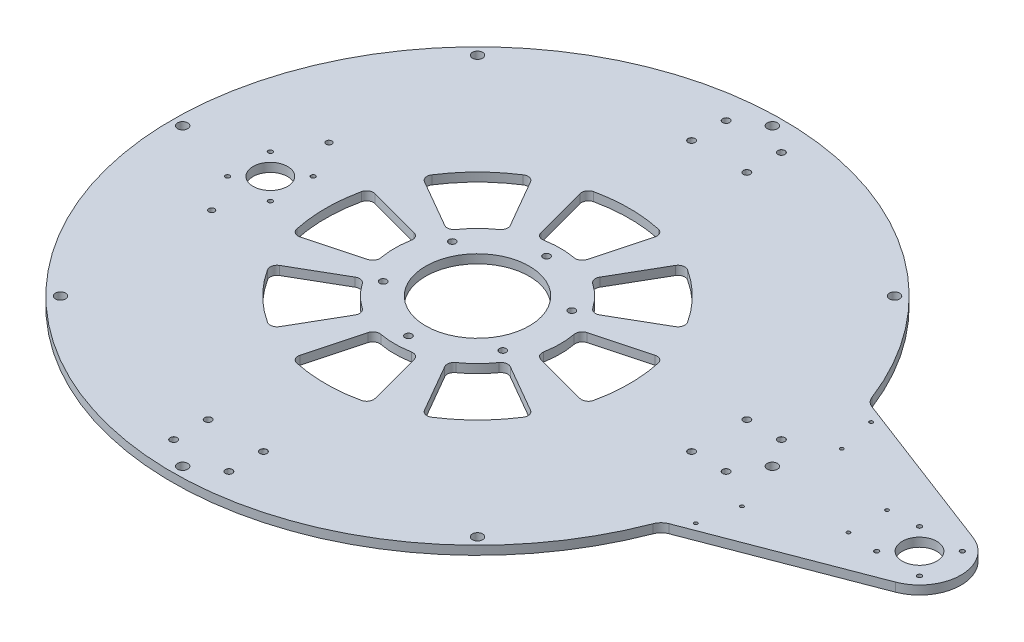
from build123d import *

# Parameters (mm, degrees)
SKETCH1_R                             = 12.5
SKETCH1_R_2                           = 37.5
BOSS_EXTRUDE1_DEPTH                   = 6.35
M7_CLEARANCE_HOLE1_D                  = 7.4
M3_CLEARANCE_HOLE3_D                  = 3.2
TAP_DRILL_FOR_M5X0_8_TAP2_D           = 4.2
FILLET1_R                             = 10
M3_CLEARANCE_HOLE2_D                  = 3.2
TAP_DRILL_FOR_M6X1_0_TAP1_D           = 5
TAP_DRILL_FOR_M6X1_0_TAP1_CSINK_D     = 5.05
TAP_DRILL_FOR_M6X1_0_TAP1_CSINK_ANGLE = 90
TAP_DRILL_FOR_M3X0_5_TAP2_D           = 2.5
TAP_DRILL_FOR_M6X1_0_TAP2_D           = 5


with BuildPart() as part:
    # Sketch1 → Boss-Extrude1 (new body)
    with BuildSketch(Plane(origin=(0, 0, 0), x_dir=(1, 0, 0), z_dir=(0, 1, 0))):
        with BuildLine():
            Line((330.716951859, 28.020473637), (207.884583363, 75))
            ThreePointArc((207.884583363, 75), (-221, 0), (207.884583363, -75))
            Line((207.884583363, -75), (330.716951859, -28.020473637))
            ThreePointArc((330.716951859, -28.020473637), (350, 0), (330.716951859, 28.020473637))
        make_face()
        with Locations(Location((320, 0, 0), (0, 0, 270))):
            Circle(SKETCH1_R, mode=Mode.SUBTRACT)
        with BuildLine():
            ThreePointArc((11.025011132, 58.978378492), (0, 60), (-11.025011132, 58.978378492))
            ThreePointArc((-11.025011132, 58.978378492), (-14.608576367, 59.662550195), (-16.773391191, 62.599148141))
            Line((-16.773391191, 62.599148141), (-27.145170458, 101.307155329))
            ThreePointArc((-27.145170458, 101.307155329), (-26.584899416, 105.203668949), (-23.378186151, 107.48702439))
            ThreePointArc((-23.378186151, 107.48702439), (0, 110), (23.378186151, 107.48702439))
            ThreePointArc((23.378186151, 107.48702439), (26.584899416, 105.203668949), (27.145170458, 101.307155329))
            Line((27.145170458, 101.307155329), (16.773391191, 62.599148141))
            ThreePointArc((16.773391191, 62.599148141), (14.608576367, 59.662550195), (11.025011132, 58.978378492))
        make_face(mode=Mode.SUBTRACT)
        with BuildLine():
            Line((-32.403703492, -56.124860802), (-52.440442409, -90.829510623))
            ThreePointArc((-52.440442409, -90.829510623), (-55.591865065, -93.188590374), (-59.473929876, -92.535677795))
            ThreePointArc((-59.473929876, -92.535677795), (-77.781745931, -77.781745931), (-92.535677795, -59.473929876))
            ThreePointArc((-92.535677795, -59.473929876), (-93.188590374, -55.591865065), (-90.829510623, -52.440442409))
            Line((-90.829510623, -52.440442409), (-56.124860802, -32.403703492))
            ThreePointArc((-56.124860802, -32.403703492), (-52.517617239, -31.857970413), (-49.499871509, -33.908151241))
            ThreePointArc((-49.499871509, -33.908151241), (-42.426406871, -42.426406871), (-33.908151241, -49.499871509))
            ThreePointArc((-33.908151241, -49.499871509), (-31.857970413, -52.517617239), (-32.403703492, -56.124860802))
        make_face(mode=Mode.SUBTRACT)
        with BuildLine():
            Line((16.773391191, -62.599148141), (27.145170458, -101.307155329))
            ThreePointArc((27.145170458, -101.307155329), (26.584899416, -105.203668949), (23.378186151, -107.48702439))
            ThreePointArc((23.378186151, -107.48702439), (0, -110), (-23.378186151, -107.48702439))
            ThreePointArc((-23.378186151, -107.48702439), (-26.584899416, -105.203668949), (-27.145170458, -101.307155329))
            Line((-27.145170458, -101.307155329), (-16.773391191, -62.599148141))
            ThreePointArc((-16.773391191, -62.599148141), (-14.608576367, -59.662550195), (-11.025011132, -58.978378492))
            ThreePointArc((-11.025011132, -58.978378492), (0, -60), (11.025011132, -58.978378492))
            ThreePointArc((11.025011132, -58.978378492), (14.608576367, -59.662550195), (16.773391191, -62.599148141))
        make_face(mode=Mode.SUBTRACT)
        with BuildLine():
            Line((56.124860802, -32.403703492), (90.829510623, -52.440442409))
            ThreePointArc((90.829510623, -52.440442409), (93.188590374, -55.591865065), (92.535677795, -59.473929876))
            ThreePointArc((92.535677795, -59.473929876), (77.781745931, -77.781745931), (59.473929876, -92.535677795))
            ThreePointArc((59.473929876, -92.535677795), (55.591865065, -93.188590374), (52.440442409, -90.829510623))
            Line((52.440442409, -90.829510623), (32.403703492, -56.124860802))
            ThreePointArc((32.403703492, -56.124860802), (31.857970413, -52.517617239), (33.908151241, -49.499871509))
            ThreePointArc((33.908151241, -49.499871509), (42.426406871, -42.426406871), (49.499871509, -33.908151241))
            ThreePointArc((49.499871509, -33.908151241), (52.517617239, -31.857970413), (56.124860802, -32.403703492))
        make_face(mode=Mode.SUBTRACT)
        with BuildLine():
            Line((62.599148141, 16.773391191), (101.307155329, 27.145170458))
            ThreePointArc((101.307155329, 27.145170458), (105.203668949, 26.584899416), (107.48702439, 23.378186151))
            ThreePointArc((107.48702439, 23.378186151), (110, 0), (107.48702439, -23.378186151))
            ThreePointArc((107.48702439, -23.378186151), (105.203668949, -26.584899416), (101.307155329, -27.145170458))
            Line((101.307155329, -27.145170458), (62.599148141, -16.773391191))
            ThreePointArc((62.599148141, -16.773391191), (59.662550195, -14.608576367), (58.978378492, -11.025011132))
            ThreePointArc((58.978378492, -11.025011132), (60, 0), (58.978378492, 11.025011132))
            ThreePointArc((58.978378492, 11.025011132), (59.662550195, 14.608576367), (62.599148141, 16.773391191))
        make_face(mode=Mode.SUBTRACT)
        with Locations(Location((-150, 0, 0), (0, 0, 270))):
            Circle(SKETCH1_R, mode=Mode.SUBTRACT)
        with BuildLine():
            Line((-62.599148141, -16.773391191), (-101.307155329, -27.145170458))
            ThreePointArc((-101.307155329, -27.145170458), (-105.203668949, -26.584899416), (-107.48702439, -23.378186151))
            ThreePointArc((-107.48702439, -23.378186151), (-110, 0), (-107.48702439, 23.378186151))
            ThreePointArc((-107.48702439, 23.378186151), (-105.203668949, 26.584899416), (-101.307155329, 27.145170458))
            Line((-101.307155329, 27.145170458), (-62.599148141, 16.773391191))
            ThreePointArc((-62.599148141, 16.773391191), (-59.662550195, 14.608576367), (-58.978378492, 11.025011132))
            ThreePointArc((-58.978378492, 11.025011132), (-60, 0), (-58.978378492, -11.025011132))
            ThreePointArc((-58.978378492, -11.025011132), (-59.662550195, -14.608576367), (-62.599148141, -16.773391191))
        make_face(mode=Mode.SUBTRACT)
        with Locations(Location((0, 0, 0), (0, 0, 270))):
            Circle(SKETCH1_R_2, mode=Mode.SUBTRACT)
        with BuildLine():
            Line((-56.124860802, 32.403703492), (-90.829510623, 52.440442409))
            ThreePointArc((-90.829510623, 52.440442409), (-93.188590374, 55.591865065), (-92.535677795, 59.473929876))
            ThreePointArc((-92.535677795, 59.473929876), (-77.781745931, 77.781745931), (-59.473929876, 92.535677795))
            ThreePointArc((-59.473929876, 92.535677795), (-55.591865065, 93.188590374), (-52.440442409, 90.829510623))
            Line((-52.440442409, 90.829510623), (-32.403703492, 56.124860802))
            ThreePointArc((-32.403703492, 56.124860802), (-31.857970413, 52.517617239), (-33.908151241, 49.499871509))
            ThreePointArc((-33.908151241, 49.499871509), (-42.426406871, 42.426406871), (-49.499871509, 33.908151241))
            ThreePointArc((-49.499871509, 33.908151241), (-52.517617239, 31.857970413), (-56.124860802, 32.403703492))
        make_face(mode=Mode.SUBTRACT)
        with BuildLine():
            Line((32.403703492, 56.124860802), (52.440442409, 90.829510623))
            ThreePointArc((52.440442409, 90.829510623), (55.591865065, 93.188590374), (59.473929876, 92.535677795))
            ThreePointArc((59.473929876, 92.535677795), (77.781745931, 77.781745931), (92.535677795, 59.473929876))
            ThreePointArc((92.535677795, 59.473929876), (93.188590374, 55.591865065), (90.829510623, 52.440442409))
            Line((90.829510623, 52.440442409), (56.124860802, 32.403703492))
            ThreePointArc((56.124860802, 32.403703492), (52.517617239, 31.857970413), (49.499871509, 33.908151241))
            ThreePointArc((49.499871509, 33.908151241), (42.426406871, 42.426406871), (33.908151241, 49.499871509))
            ThreePointArc((33.908151241, 49.499871509), (31.857970413, 52.517617239), (32.403703492, 56.124860802))
        make_face(mode=Mode.SUBTRACT)
    extrude(amount=-BOSS_EXTRUDE1_DEPTH)

    # M7 Clearance Hole1 (through all)
    with Locations(Plane(origin=(0, 0, -213.5), x_dir=(0, 0, 1), z_dir=(0, 1, 0))):
        with Locations((0, 0), (62.532702217, 150.967297783), (213.5, 213.5), (364.467297783, 150.967297783), (427, 0), (364.467297783, -150.967297783), (62.532702217, -150.967297783), (213.5, -213.5)):
            Hole(M7_CLEARANCE_HOLE1_D / 2)

    # M3 Clearance Hole3 (through all)
    with Locations(Plane(origin=(-165.5, 0, -15.5), x_dir=(0, 0, 1), z_dir=(0, 1, 0))):
        with Locations((0, 0), (0, 31), (31, 31), (31, 0)):
            Hole(M3_CLEARANCE_HOLE3_D / 2)

    # Tap Drill for M5x0.8 Tap2 (through all)
    with Locations(Plane(origin=(-150, 0, 42.426406871), x_dir=(0, 0, 1), z_dir=(0, 1, 0))):
        with Locations((0, 0), (-84.852813742, 0)):
            Hole(TAP_DRILL_FOR_M5X0_8_TAP2_D / 2)

    # Fillet1
    fillet1_edges = [part.edges().sort_by_distance(p)[0] for p in [
        (207.884583363, -3.175, -75),
        (207.884583363, -3.175, 75),
    ]]
    fillet(fillet1_edges, radius=FILLET1_R)

    # M3 Clearance Hole2 (through all)
    with Locations(Plane(origin=(304.5, 0, 15.5), x_dir=(0, 0, 1), z_dir=(0, 1, 0))):
        with Locations((0, 0), (-31, 0), (-31, 31), (0, 31)):
            Hole(M3_CLEARANCE_HOLE2_D / 2)

    # Tap Drill for M6x1.0 Tap1 (through all)
    with Locations(Plane(origin=(-20, 0, 175), x_dir=(0, 0, 1), z_dir=(0, 1, 0))):
        with Locations((0, 0), (0, 40), (25, 0), (25, 40), (-155, 220), (-195, 195), (-195, 220), (-155, 195), (-375, 0), (-375, 40), (-350, 40), (-350, 0)):
            CounterSinkHole(TAP_DRILL_FOR_M6X1_0_TAP1_D / 2, TAP_DRILL_FOR_M6X1_0_TAP1_CSINK_D / 2, counter_sink_angle=TAP_DRILL_FOR_M6X1_0_TAP1_CSINK_ANGLE)

    # Tap Drill for M3x0.5 Tap2 (through all)
    with Locations(Plane(origin=(221.517927042, 0, -63.449255305), x_dir=(0, 0, 1), z_dir=(0, 1, 0))):
        with Locations((0, 0), (27.336288199, 6.060309191), (99.562222411, 6.060309191), (126.89851061, 0), (49.449255305, 60.982072958), (77.449255305, 60.982072958)):
            Hole(TAP_DRILL_FOR_M3X0_5_TAP2_D / 2)

    # Tap Drill for M6x1.0 Tap2 (through all)
    with Locations(Plane(origin=(0, 0, -50), x_dir=(0, 0, 1), z_dir=(0, 1, 0))):
        with Locations((0, 0), (25, 43.301270189), (25, -43.301270189), (75, -43.301270189), (100, 0), (75, 43.301270189)):
            Hole(TAP_DRILL_FOR_M6X1_0_TAP2_D / 2)


solid = part.part
